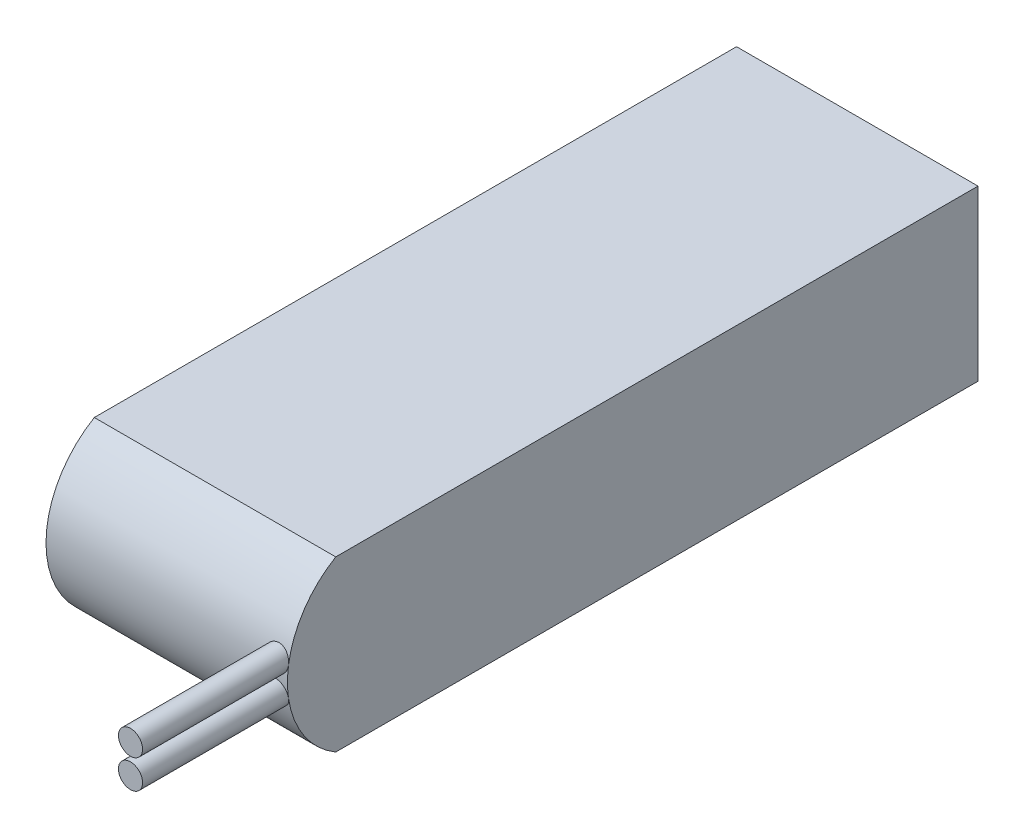
from build123d import *

# Parameters (mm, degrees)
ESQUISSE1_W        = 50
ESQUISSE1_H        = 35
BOSS_EXTRU_1_DEPTH = 133
BOSS_EXTRU_2_DEPTH = 50
ESQUISSE3_R        = 2.5
BOSS_EXTRU_3_DEPTH = 173


with BuildPart() as part:
    # Esquisse1 → Boss.-Extru.1 (new body)
    with BuildSketch(Plane.XY):
        with Locations((25, 17.5)):
            Rectangle(ESQUISSE1_W, ESQUISSE1_H)
    extrude(amount=BOSS_EXTRU_1_DEPTH)

    # Esquisse2 → Boss.-Extru.2 (add)
    with BuildSketch(Plane(origin=(50, 0, 0), x_dir=(0, 0, -1), z_dir=(1, 0, 0))):
        with BuildLine():
            Line((-133, 35), (-133, 0))
            ThreePointArc((-133, 0), (-143, 17.5), (-133, 35))
        make_face()
    extrude(amount=-BOSS_EXTRU_2_DEPTH)

    # Esquisse3 → Boss.-Extru.3 (add)
    with BuildSketch(Plane(origin=(0, 0, 0), x_dir=(-1, 0, 0), z_dir=(0, 0, -1))):
        with Locations((-47.5, 20.5)):
            Circle(ESQUISSE3_R)
        with Locations((-47.5, 14.5)):
            Circle(ESQUISSE3_R)
    extrude(amount=-BOSS_EXTRU_3_DEPTH)


solid = part.part
